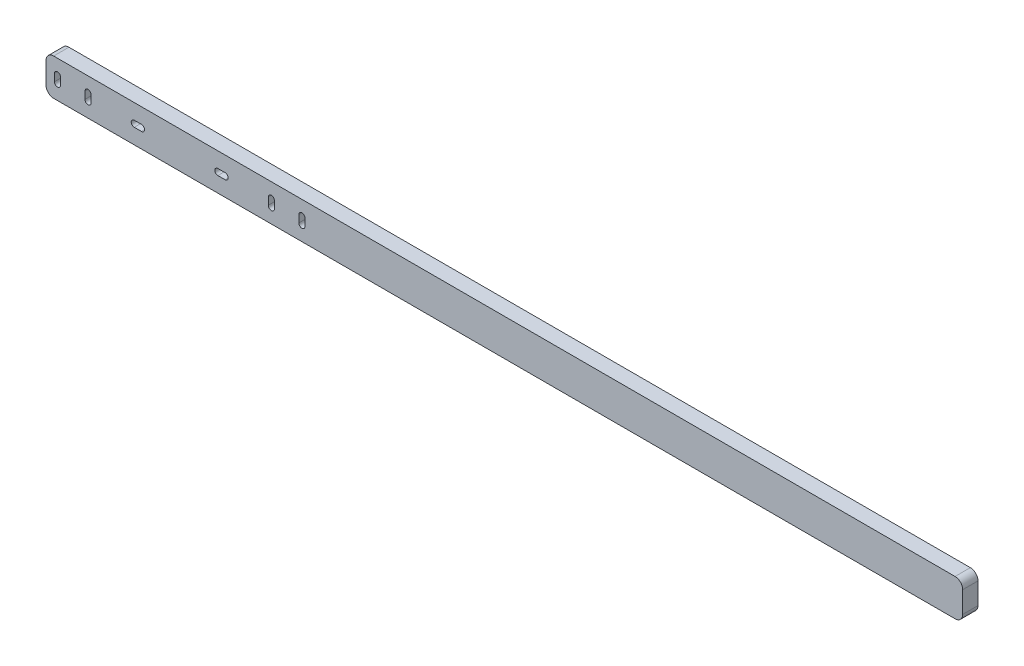
from build123d import *

# Parameters (mm, degrees)
SALIENTE_EXTRUIR1_DEPTH = 6.35


with BuildPart() as part:
    # Croquis1 → Saliente-Extruir1 (new body)
    with BuildSketch(Plane.XY):
        with BuildLine():
            Line((-187.325, -7.62), (187.325, -7.62))
            ThreePointArc((187.325, -7.62), (189.57006403, -6.69006403), (190.5, -4.445))
            Line((190.5, -4.445), (190.5, 4.445))
            ThreePointArc((190.5, 4.445), (189.57006403, 6.69006403), (187.325, 7.62))
            Line((187.325, 7.62), (-187.325, 7.62))
            ThreePointArc((-187.325, 7.62), (-189.57006403, 6.69006403), (-190.5, 4.445))
            Line((-190.5, 4.445), (-190.5, -4.445))
            ThreePointArc((-190.5, -4.445), (-189.57006403, -6.69006403), (-187.325, -7.62))
        make_face()
        with BuildLine():
            Line((-187.0075, -1.5), (-187.0075, 1.5))
            ThreePointArc((-187.0075, 1.5), (-185.7375, 2.77), (-184.4675, 1.5))
            Line((-184.4675, 1.5), (-184.4675, -1.5))
            ThreePointArc((-184.4675, -1.5), (-185.7375, -2.77), (-187.0075, -1.5))
        make_face(mode=Mode.SUBTRACT)
        with BuildLine():
            Line((-98.1075, -1.5), (-98.1075, 1.5))
            ThreePointArc((-98.1075, 1.5), (-96.8375, 2.77), (-95.5675, 1.5))
            Line((-95.5675, 1.5), (-95.5675, -1.5))
            ThreePointArc((-95.5675, -1.5), (-96.8375, -2.77), (-98.1075, -1.5))
        make_face(mode=Mode.SUBTRACT)
        with BuildLine():
            Line((-171.7675, -1.5), (-171.7675, 1.5))
            ThreePointArc((-171.7675, 1.5), (-173.0375, 2.77), (-174.3075, 1.5))
            Line((-174.3075, 1.5), (-174.3075, -1.5))
            ThreePointArc((-174.3075, -1.5), (-173.0375, -2.77), (-171.7675, -1.5))
        make_face(mode=Mode.SUBTRACT)
        with BuildLine():
            Line((-82.8675, -1.5), (-82.8675, 1.5))
            ThreePointArc((-82.8675, 1.5), (-84.1375, 2.77), (-85.4075, 1.5))
            Line((-85.4075, 1.5), (-85.4075, -1.5))
            ThreePointArc((-85.4075, -1.5), (-84.1375, -2.77), (-82.8675, -1.5))
        make_face(mode=Mode.SUBTRACT)
        with BuildLine():
            Line((-153.8125, 1.27), (-150.8125, 1.27))
            ThreePointArc((-150.8125, 1.27), (-149.5425, 0), (-150.8125, -1.27))
            Line((-150.8125, -1.27), (-153.8125, -1.27))
            ThreePointArc((-153.8125, -1.27), (-155.0825, 0), (-153.8125, 1.27))
        make_face(mode=Mode.SUBTRACT)
        with BuildLine():
            Line((-116.0625, 1.27), (-119.0625, 1.27))
            ThreePointArc((-119.0625, 1.27), (-120.3325, 0), (-119.0625, -1.27))
            Line((-119.0625, -1.27), (-116.0625, -1.27))
            ThreePointArc((-116.0625, -1.27), (-114.7925, 0), (-116.0625, 1.27))
        make_face(mode=Mode.SUBTRACT)
    extrude(amount=SALIENTE_EXTRUIR1_DEPTH)


solid = part.part
